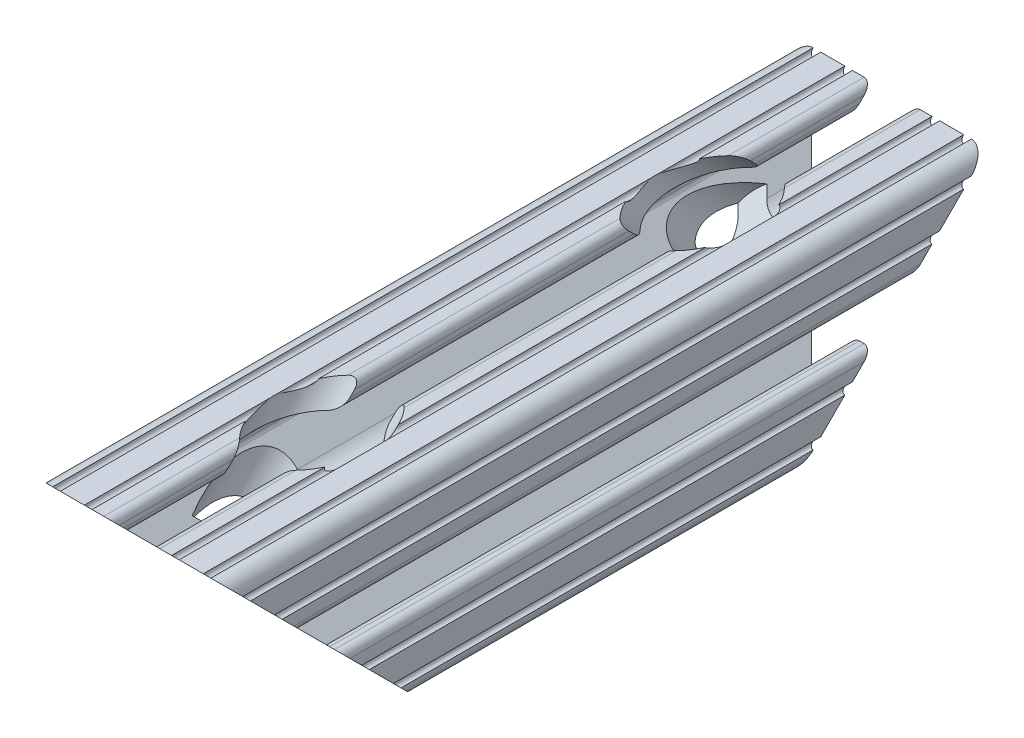
from build123d import *

# Parameters (mm, degrees)
SKETCH1_R               = 3.3274
BOSS_EXTRUDE1_DEPTH     = 76.2
CUT_EXTRUDE1_DEPTH      = 81.822361732
CUT_EXTRUDE1_DEPTH_BACK = 81.822361732


with BuildPart() as part:
    # Sketch1 → Boss-Extrude1 (new, symmetric)
    with BuildSketch(Plane.XY):
        with BuildLine():
            Line((-10.287, 13.552357131), (-10.287, 14.0843))
            ThreePointArc((-10.287, 14.0843), (-10.022898185, 14.721898185), (-9.3853, 14.986))
            Line((-9.3853, 14.986), (-5.617617549, 14.986))
            ThreePointArc((-5.617617549, 14.986), (-4.519044045, 15.441044045), (-4.064, 16.539617549))
            Line((-4.064, 16.539617549), (-4.064, 17.496382451))
            ThreePointArc((-4.064, 17.496382451), (-4.519044045, 18.594955955), (-5.617617549, 19.05))
            Line((-5.617617549, 19.05), (-7.974178704, 19.05))
            ThreePointArc((-7.974178704, 19.05), (-8.736178704, 18.288), (-9.498178704, 19.05))
            Line((-9.498178704, 19.05), (-14.327719207, 19.05))
            ThreePointArc((-14.327719207, 19.05), (-15.087603123, 18.231251131), (-15.847487039, 19.05))
            ThreePointArc((-15.847487039, 19.05), (-18.120176289, 18.120192083), (-19.05, 15.847509295))
            ThreePointArc((-19.05, 15.847509295), (-18.231250992, 15.08762539), (-19.05, 14.327741484))
            Line((-19.05, 14.327741484), (-19.05, 9.496091471))
            ThreePointArc((-19.05, 9.496091471), (-18.231250992, 8.736207565), (-19.05, 7.97632366))
            Line((-19.05, 7.97632366), (-19.05, 5.617617549))
            ThreePointArc((-19.05, 5.617617549), (-18.594955955, 4.519044045), (-17.496382451, 4.064))
            Line((-17.496382451, 4.064), (-16.539617549, 4.064))
            ThreePointArc((-16.539617549, 4.064), (-15.441044045, 4.519044045), (-14.986, 5.617617549))
            Line((-14.986, 5.617617549), (-14.986, 9.385342516))
            ThreePointArc((-14.986, 9.385342516), (-14.721898185, 10.022940701), (-14.0843, 10.287042516))
            Line((-14.0843, 10.287042516), (-13.516042086, 10.287042516))
            ThreePointArc((-13.516042086, 10.287042516), (-13.170975923, 10.218404478), (-12.878443117, 10.022939917))
            Line((-12.878443117, 10.022939917), (-8.14758008, 5.292065243))
            ThreePointArc((-8.14758008, 5.292065243), (-7.117955879, 3.751120653), (-6.7564, 1.933453584))
            Line((-6.7564, 1.933453584), (-6.7564, -1.933453584))
            ThreePointArc((-6.7564, -1.933453584), (-7.117955879, -3.751120653), (-8.14758008, -5.292065243))
            Line((-8.14758008, -5.292065243), (-12.878443117, -10.022939917))
            ThreePointArc((-12.878443117, -10.022939917), (-13.170975923, -10.218404478), (-13.516042086, -10.287042516))
            Line((-13.516042086, -10.287042516), (-14.0843, -10.287042516))
            ThreePointArc((-14.0843, -10.287042516), (-14.721898185, -10.022940701), (-14.986, -9.385342516))
            Line((-14.986, -9.385342516), (-14.986, -5.617617549))
            ThreePointArc((-14.986, -5.617617549), (-15.441044045, -4.519044045), (-16.539617549, -4.064))
            Line((-16.539617549, -4.064), (-17.496382451, -4.064))
            ThreePointArc((-17.496382451, -4.064), (-18.594955955, -4.519044045), (-19.05, -5.617617549))
            Line((-19.05, -5.617617549), (-19.05, -7.976318491))
            ThreePointArc((-19.05, -7.976318491), (-18.231250992, -8.736202396), (-19.05, -9.496086302))
            Line((-19.05, -9.496086302), (-19.05, -14.32774291))
            ThreePointArc((-19.05, -14.32774291), (-18.231250992, -15.087626816), (-19.05, -15.847510721))
            ThreePointArc((-19.05, -15.847510721), (-18.120175716, -18.120192644), (-15.847486868, -19.05))
            ThreePointArc((-15.847486868, -19.05), (-15.087602952, -18.231251131), (-14.327719036, -19.05))
            Line((-14.327719036, -19.05), (-9.496062448, -19.05))
            ThreePointArc((-9.496062448, -19.05), (-8.736178532, -18.231251131), (-7.976294616, -19.05))
            Line((-7.976294616, -19.05), (-5.617617549, -19.05))
            ThreePointArc((-5.617617549, -19.05), (-4.519044045, -18.594955955), (-4.064, -17.496382451))
            Line((-4.064, -17.496382451), (-4.064, -16.539617549))
            ThreePointArc((-4.064, -16.539617549), (-4.519044045, -15.441044045), (-5.617617549, -14.986))
            Line((-5.617617549, -14.986), (-9.3853, -14.986))
            ThreePointArc((-9.3853, -14.986), (-10.022898185, -14.721898185), (-10.287, -14.0843))
            Line((-10.287, -14.0843), (-10.287, -13.552357131))
            ThreePointArc((-10.287, -13.552357131), (-10.218362387, -13.207291992), (-10.022898969, -12.91475973))
            Line((-10.022898969, -12.91475973), (-5.252158105, -8.144007132))
            ThreePointArc((-5.252158105, -8.144007132), (-3.715177372, -7.117027388), (-1.902183975, -6.7564))
            Line((-1.902183975, -6.7564), (1.902183975, -6.7564))
            ThreePointArc((1.902183975, -6.7564), (3.715177372, -7.117027388), (5.252158105, -8.144007132))
            Line((5.252158105, -8.144007132), (10.022898969, -12.91475973))
            ThreePointArc((10.022898969, -12.91475973), (10.218362387, -13.207291992), (10.287, -13.552357131))
            Line((10.287, -13.552357131), (10.287, -14.0843))
            ThreePointArc((10.287, -14.0843), (10.022898185, -14.721898185), (9.3853, -14.986))
            Line((9.3853, -14.986), (5.617617549, -14.986))
            ThreePointArc((5.617617549, -14.986), (4.519044045, -15.441044045), (4.064, -16.539617549))
            Line((4.064, -16.539617549), (4.064, -17.496382451))
            ThreePointArc((4.064, -17.496382451), (4.519044045, -18.594955955), (5.617617549, -19.05))
            Line((5.617617549, -19.05), (7.976294616, -19.05))
            ThreePointArc((7.976294616, -19.05), (8.736178532, -18.231251131), (9.496062448, -19.05))
            Line((9.496062448, -19.05), (14.327719036, -19.05))
            ThreePointArc((14.327719036, -19.05), (15.087602952, -18.231251131), (15.847486868, -19.05))
            ThreePointArc((15.847486868, -19.05), (18.120175716, -18.120192644), (19.05, -15.847510721))
            ThreePointArc((19.05, -15.847510721), (18.231250992, -15.087626816), (19.05, -14.32774291))
            Line((19.05, -14.32774291), (19.05, -9.496086302))
            ThreePointArc((19.05, -9.496086302), (18.231250992, -8.736202396), (19.05, -7.976318491))
            Line((19.05, -7.976318491), (19.05, -5.617617549))
            ThreePointArc((19.05, -5.617617549), (18.594955955, -4.519044045), (17.496382451, -4.064))
            Line((17.496382451, -4.064), (16.539617549, -4.064))
            ThreePointArc((16.539617549, -4.064), (15.441044045, -4.519044045), (14.986, -5.617617549))
            Line((14.986, -5.617617549), (14.986, -9.385342516))
            ThreePointArc((14.986, -9.385342516), (14.721898185, -10.022940701), (14.0843, -10.287042516))
            Line((14.0843, -10.287042516), (13.516042086, -10.287042516))
            ThreePointArc((13.516042086, -10.287042516), (13.170975923, -10.218404478), (12.878443117, -10.022939917))
            Line((12.878443117, -10.022939917), (8.14758008, -5.292065243))
            ThreePointArc((8.14758008, -5.292065243), (7.117955879, -3.751120653), (6.7564, -1.933453584))
            Line((6.7564, -1.933453584), (6.7564, 1.933453584))
            ThreePointArc((6.7564, 1.933453584), (7.117955879, 3.751120653), (8.14758008, 5.292065243))
            Line((8.14758008, 5.292065243), (12.878443117, 10.022939917))
            ThreePointArc((12.878443117, 10.022939917), (13.170975923, 10.218404478), (13.516042086, 10.287042516))
            Line((13.516042086, 10.287042516), (14.0843, 10.287042516))
            ThreePointArc((14.0843, 10.287042516), (14.721898185, 10.022940701), (14.986, 9.385342516))
            Line((14.986, 9.385342516), (14.986, 5.617617549))
            ThreePointArc((14.986, 5.617617549), (15.441044045, 4.519044045), (16.539617549, 4.064))
            Line((16.539617549, 4.064), (17.496382451, 4.064))
            ThreePointArc((17.496382451, 4.064), (18.594955955, 4.519044045), (19.05, 5.617617549))
            Line((19.05, 5.617617549), (19.05, 7.97632366))
            ThreePointArc((19.05, 7.97632366), (18.231250992, 8.736207565), (19.05, 9.496091471))
            Line((19.05, 9.496091471), (19.05, 14.327741484))
            ThreePointArc((19.05, 14.327741484), (18.231250992, 15.08762539), (19.05, 15.847509295))
            ThreePointArc((19.05, 15.847509295), (18.120176289, 18.120192083), (15.847487039, 19.05))
            ThreePointArc((15.847487039, 19.05), (15.087603123, 18.231251131), (14.327719207, 19.05))
            Line((14.327719207, 19.05), (9.498178704, 19.05))
            ThreePointArc((9.498178704, 19.05), (8.736178704, 18.288), (7.974178704, 19.05))
            Line((7.974178704, 19.05), (5.617617549, 19.05))
            ThreePointArc((5.617617549, 19.05), (4.519044045, 18.594955955), (4.064, 17.496382451))
            Line((4.064, 17.496382451), (4.064, 16.539617549))
            ThreePointArc((4.064, 16.539617549), (4.519044045, 15.441044045), (5.617617549, 14.986))
            Line((5.617617549, 14.986), (9.3853, 14.986))
            ThreePointArc((9.3853, 14.986), (10.022898185, 14.721898185), (10.287, 14.0843))
            Line((10.287, 14.0843), (10.287, 13.552357131))
            ThreePointArc((10.287, 13.552357131), (10.218362387, 13.207291992), (10.022898969, 12.91475973))
            Line((10.022898969, 12.91475973), (5.252158105, 8.144007132))
            ThreePointArc((5.252158105, 8.144007132), (3.715177372, 7.117027388), (1.902183975, 6.7564))
            Line((1.902183975, 6.7564), (-1.902183975, 6.7564))
            ThreePointArc((-1.902183975, 6.7564), (-3.715177372, 7.117027388), (-5.252158105, 8.144007132))
            Line((-5.252158105, 8.144007132), (-10.022898969, 12.91475973))
            ThreePointArc((-10.022898969, 12.91475973), (-10.218362387, 13.207291992), (-10.287, 13.552357131))
        make_face()
        with Locations(Location((0, 0, 0), (0, 0, 180))):
            Circle(SKETCH1_R, mode=Mode.SUBTRACT)
    extrude(amount=BOSS_EXTRUDE1_DEPTH, both=True)

    # Sketch2 → Cut-Extrude1 (cut, two sides: drawn at the far end of the back side and taken through both)
    with BuildSketch(Plane(origin=(0, 0, 0), x_dir=(0, 0, -1), z_dir=(1, 0, 0)).offset(-CUT_EXTRUDE1_DEPTH_BACK)):
        Polygon((-76.2, 19.05), (-76.2, -25.4), (-31.75, -25.4), align=None)
        Polygon((31.75, -25.4), (76.2, 19.05), (76.2, -25.4), align=None)
    extrude(amount=CUT_EXTRUDE1_DEPTH + CUT_EXTRUDE1_DEPTH_BACK, mode=Mode.SUBTRACT)

    # Sketch3 → Cut-Revolve1 (revolve, cut)
    with BuildSketch(Plane(origin=(0, 0, 0), x_dir=(0, 0, -1), z_dir=(1, 0, 0))):
        Polygon((-31.364807909, 25.785192091), (-57.15, 0), (-59.457925823, 2.307925823), (-54.967797763, 6.798053884), (-59.39506403, 11.225320151), (-38.1, 32.520384182), align=None)
    cut_revolve1 = revolve(axis=Axis((0, 0, 57.15), (0, -0.7071067811865462, 0.7071067811865488)), mode=Mode.SUBTRACT)

    # Mirror1: Cut-Revolve1 across plane
    add(cut_revolve1.mirror(Plane.XY), mode=Mode.SUBTRACT)


solid = part.part
